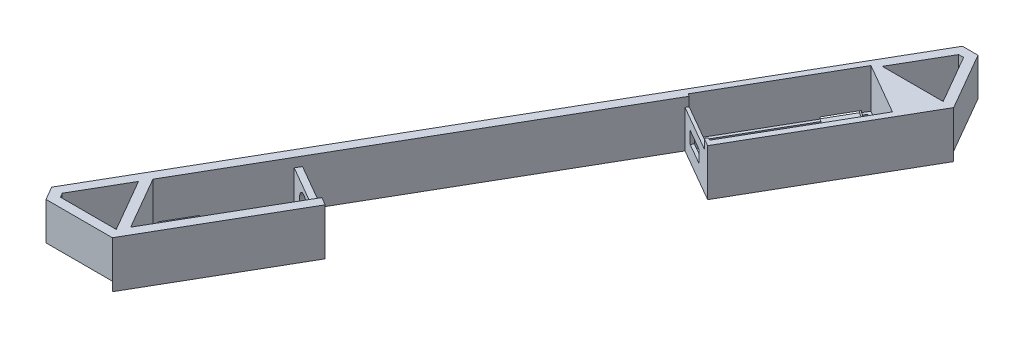
from build123d import *

# Parameters (mm, degrees)
BOSS_EXTRUDE2_DEPTH = 15.38
BOSS_EXTRUDE3_DEPTH = 1
BOSS_EXTRUDE4_DEPTH = 12.38
CUT_EXTRUDE1_DEPTH  = 8.26
SKETCH12_R          = 4
CUT_EXTRUDE2_DEPTH  = 8.26
CUT_EXTRUDE3_DEPTH  = 3
SKETCH16_W          = 10
SKETCH16_H          = 2
CUT_EXTRUDE4_DEPTH  = 3
CUT_EXTRUDE5_DEPTH  = 13
CUT_EXTRUDE6_DEPTH  = 1


with BuildPart() as part:
    # Sketch1 → Boss-Extrude2 (new body)
    with BuildSketch(Plane(origin=(0, 0, 0), x_dir=(1, 0, 0), z_dir=(0, 1, 0))):
        Polygon((-33.232050802, 130.626242439), (-11.732050802, 167.865334802), (3.267949197, 159.205080764), (-18.232050803, 121.965988402), (-18.732050803, 121.099962998), (-16.133974592, 119.599962998), (13.464101619, 170.865334801), (2.556624332, 189.757639644), (-2.556624322, 189.757639644), (-112.11324865, 2e-09), (-109.556624323, -4.428203228), (-87.74166975, -4.428203228), (-62.14359354, 39.908965344), (-64.74166975, 41.408965344), (-65.74166975, 39.676914536), (-82.74166975, 10.232050807), (-87.74166975, 1.57179677), (-97.741669749, 18.892304845), (-80.741669749, 48.337168573), (-79.741669749, 50.069219381), (-33.732050802, 129.760217035), align=None)
        Polygon((-89.473720558, -1.42820323), (-107.824573519, -1.42820323), (-108.649147039, 0), (-99.473720558, 15.892304845), align=None, mode=Mode.SUBTRACT)
        Polygon((-9.999999996, 170.865334801), (-0.824573515, 186.757639646), (0.824573508, 186.757639646), (10.000000004, 170.865334801), align=None, mode=Mode.SUBTRACT)
    extrude(amount=BOSS_EXTRUDE2_DEPTH)

    # Sketch1<11> → Boss-Extrude3 (add)
    with BuildSketch(Plane(origin=(0, 0, 0), x_dir=(1, 0, 0), z_dir=(0, 1, 0))):
        Polygon((3.267949197, 159.205080764), (-11.732050802, 167.865334802), (-33.232050802, 130.626242439), (-18.232050803, 121.965988402), align=None)
        Polygon((-65.74166975, 39.676914536), (-80.741669749, 48.337168573), (-97.741669749, 18.892304845), (-87.74166975, 1.57179677), align=None)
    extrude(amount=BOSS_EXTRUDE3_DEPTH)

    # Sketch1<12> → Boss-Extrude4 (add)
    with BuildSketch(Plane(origin=(0, 0, 0), x_dir=(1, 0, 0), z_dir=(0, 1, 0))):
        Polygon((-18.232050803, 121.965988402), (-33.232050802, 130.626242439), (-33.732050802, 129.760217035), (-18.732050803, 121.099962998), align=None)
        Polygon((-64.74166975, 41.408965344), (-79.741669749, 50.069219381), (-80.741669749, 48.337168573), (-65.74166975, 39.676914536), align=None)
    extrude(amount=BOSS_EXTRUDE4_DEPTH)

    # Sketch10 → Cut-Extrude1 (cut)
    with BuildSketch(Plane(origin=(47.754809476, 0, -82.713756318), x_dir=(0.8660254037844418, 0, 0.49999999999999456), z_dir=(-0.4999999999999946, 0, 0.8660254037844419))):
        Polygon((-85.432921433, 5), (-81.432921433, 5), (-81.432921433, 9), (-89.432921433, 9), (-89.432921433, 5), align=None)
    extrude(amount=-CUT_EXTRUDE1_DEPTH, mode=Mode.SUBTRACT)

    # Sketch12 → Cut-Extrude2 (cut)
    with BuildSketch(Plane(origin=(1.745190528, 0, -3.022758664), x_dir=(-0.866025403784436, 0, -0.5000000000000047), z_dir=(0.5000000000000047, 0, -0.866025403784436))):
        with Locations((85.432921433, 6.5)):
            Circle(SKETCH12_R)
    extrude(amount=-CUT_EXTRUDE2_DEPTH, mode=Mode.SUBTRACT)

    # Sketch15 → Cut-Extrude3 (cut)
    with BuildSketch(Plane.XZ):
        Polygon((-87.74166975, 4.428203228), (-109.556624323, 4.428203228), (-112.11324865, -2e-09), (-101.205771363, -18.892304845), align=None)
        Polygon((13.464101619, -170.865334801), (2.556624332, -189.757639644), (-2.556624322, -189.757639644), (-13.464101609, -170.865334801), align=None)
    extrude(amount=-CUT_EXTRUDE3_DEPTH, mode=Mode.SUBTRACT)

    # Sketch16 → Cut-Extrude4 (cut)
    with BuildSketch(Plane(origin=(-84.084936489, 0, -48.546460716), x_dir=(-0.4999999999999999, 0, 0.8660254037844386), z_dir=(-0.8660254037844387, 0, -0.49999999999999994))):
        with Locations((-133.242624333, 2)):
            Rectangle(SKETCH16_W, SKETCH16_H)
        with Locations((26.242624323, 2)):
            Rectangle(SKETCH16_W, SKETCH16_H)
    extrude(amount=-CUT_EXTRUDE4_DEPTH, mode=Mode.SUBTRACT)

    # Sketch17 → Cut-Extrude5 (cut)
    with BuildSketch(Plane(origin=(0, 15.38, 0), x_dir=(1, 0, 0), z_dir=(0, 1, 0))):
        Polygon((-18.232050803, 121.965988402), (-17.366025399, 121.465988402), (4.633974601, 159.571106168), (-12.098076205, 169.231360205), (-34.098076205, 131.126242439), (-33.232050802, 130.626242439), align=None)
    extrude(amount=-CUT_EXTRUDE5_DEPTH, mode=Mode.SUBTRACT)

    # Sketch18 → Cut-Extrude6 (cut)
    with BuildSketch(Plane.XZ):
        Polygon((-18.232050803, -121.965988402), (3.267949197, -159.205080764), (-11.732050802, -167.865334802), (-33.232050802, -130.626242439), align=None)
    extrude(amount=-CUT_EXTRUDE6_DEPTH, mode=Mode.SUBTRACT)


solid = part.part
